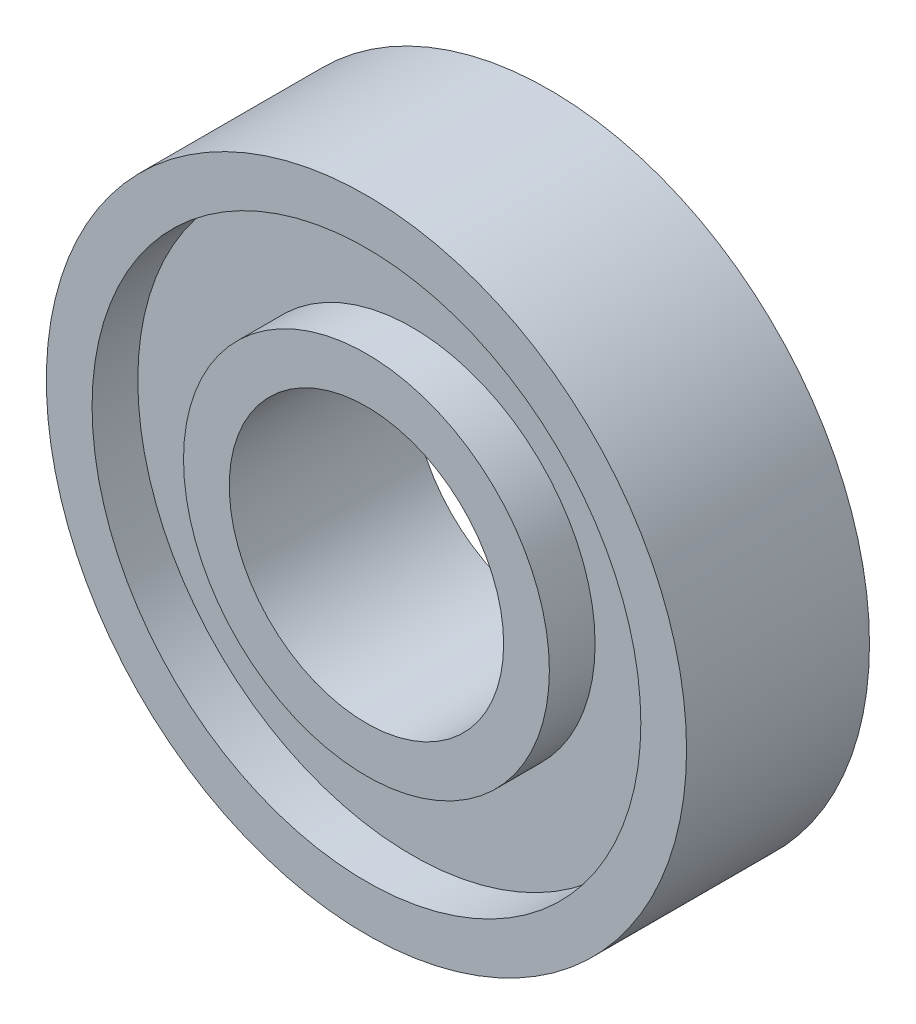
from build123d import *

# Parameters (mm, degrees)
SKETCH1_R             = 3.5
SKETCH1_R_2           = 3
BOSS_EXTRUDE1_DEPTH   = 2
SKETCH1_R_3           = 2
SKETCH1_R_4           = 1.5
BOSS_EXTRUDE1_2_DEPTH = 2
BOSS_EXTRUDE2_START   = -1.2e-05
SKETCH1_3_R           = 3
SKETCH1_3_R_2         = 2
BOSS_EXTRUDE2_DEPTH   = 2.000012
SKETCH2_R             = 3
SKETCH2_R_2           = 2
CUT_EXTRUDE3_DEPTH    = 0.5
CUT_EXTRUDE4_START    = -0.5
SKETCH3_R             = 3
SKETCH3_R_2           = 2
CUT_EXTRUDE4_DEPTH    = 0.5


with BuildPart() as part:
    # Sketch1 → Boss-Extrude1 (new body)
    with BuildSketch(Plane.XY):
        Circle(SKETCH1_R)
        Circle(SKETCH1_R_2, mode=Mode.SUBTRACT)
    extrude(amount=BOSS_EXTRUDE1_DEPTH)


with BuildPart() as body_2:
    # Sketch1 → Boss-Extrude1 2 (new body)
    with BuildSketch(Plane.XY):
        Circle(SKETCH1_R_3)
        Circle(SKETCH1_R_4, mode=Mode.SUBTRACT)
    extrude(amount=BOSS_EXTRUDE1_2_DEPTH)


with BuildPart() as body_3:
    # Sketch1<3> → Boss-Extrude2 (new body)
    with BuildSketch(Plane.XY.offset(BOSS_EXTRUDE2_START)):
        Circle(SKETCH1_3_R)
        Circle(SKETCH1_3_R_2, mode=Mode.SUBTRACT)
    extrude(amount=BOSS_EXTRUDE2_DEPTH)

    # Sketch2 → Cut-Extrude3 (cut)
    with BuildSketch(Plane(origin=(0, 0, -1.2e-05), x_dir=(-1, 0, 0), z_dir=(0, 0, -1))):
        Circle(SKETCH2_R)
        Circle(SKETCH2_R_2, mode=Mode.SUBTRACT)
    extrude(amount=-CUT_EXTRUDE3_DEPTH, mode=Mode.SUBTRACT)

    # Sketch3 → Cut-Extrude4 (cut)
    with BuildSketch(Plane.XY.offset(2).offset(CUT_EXTRUDE4_START)):
        with Locations(Location((0, 0, 0), (0, 0, 180))):
            Circle(SKETCH3_R)
        with Locations(Location((0, 0, 0), (0, 0, 180))):
            Circle(SKETCH3_R_2, mode=Mode.SUBTRACT)
    extrude(amount=CUT_EXTRUDE4_DEPTH, mode=Mode.SUBTRACT)


solid = Compound([part.part, body_2.part, body_3.part])
